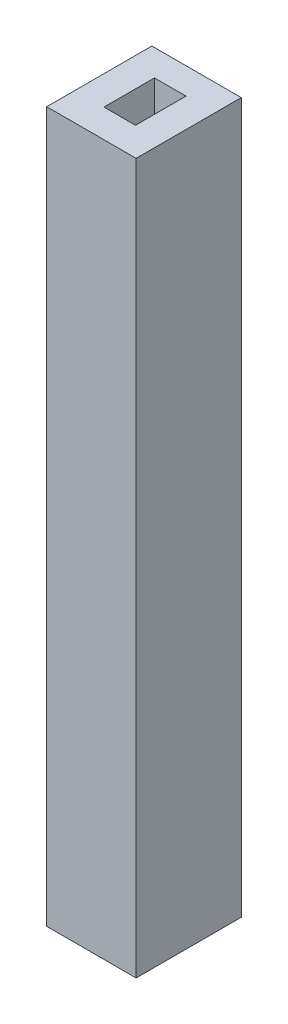
from build123d import *

# Parameters (mm, degrees)
SKETCH_1_W          = 40
SKETCH_1_H          = 270
EXTRUDE_1_DEPTH     = 17
CUT_EXTRUDE_1_DEPTH = 6


with BuildPart() as part:
    # 스케치1 → 보스-돌출1 (new, symmetric)
    with BuildSketch(Plane(origin=(0, 0, 0), x_dir=(0, 0, -1), z_dir=(1, 0, 0))):
        with Locations((0, -135)):
            Rectangle(SKETCH_1_W, SKETCH_1_H)
    extrude(amount=EXTRUDE_1_DEPTH, both=True)

    # 스케치2 → 컷-돌출1 (cut, symmetric)
    with BuildSketch(Plane(origin=(0, 0, 0), x_dir=(0, 0, -1), z_dir=(1, 0, 0))):
        Polygon((-9.231313733, 0), (-9.231313733, -13.51839175), (-5.020847881, -120), (9.979152119, -120), (9.979152119, 0), align=None)
    extrude(amount=CUT_EXTRUDE_1_DEPTH, both=True, mode=Mode.SUBTRACT)


solid = part.part
